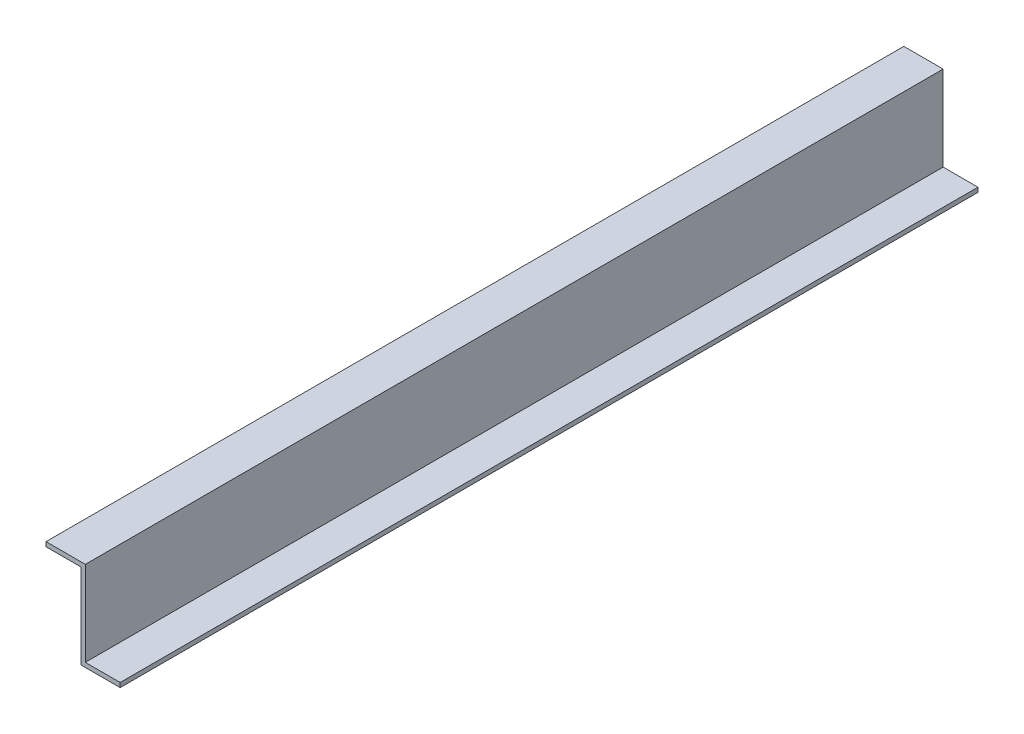
from build123d import *

# Parameters (mm, degrees)
BOSS_EXTRUDE1_DEPTH      = 152.4
BOSS_EXTRUDE1_DEPTH_BACK = 152.4


with BuildPart() as part:
    # Sketch3 → Boss-Extrude1 (new, two sides: drawn at the far end of the back side and taken through both)
    with BuildSketch(Plane.XY.offset(-BOSS_EXTRUDE1_DEPTH_BACK)):
        Polygon((13.17625, -14.2875), (13.17625, -15.875), (-0.79375, -15.875), (-0.79375, 14.2875), (-13.17625, 14.2875), (-13.17625, 15.875), (0.79375, 15.875), (0.79375, -14.2875), align=None)
    extrude(amount=BOSS_EXTRUDE1_DEPTH + BOSS_EXTRUDE1_DEPTH_BACK)


solid = part.part
